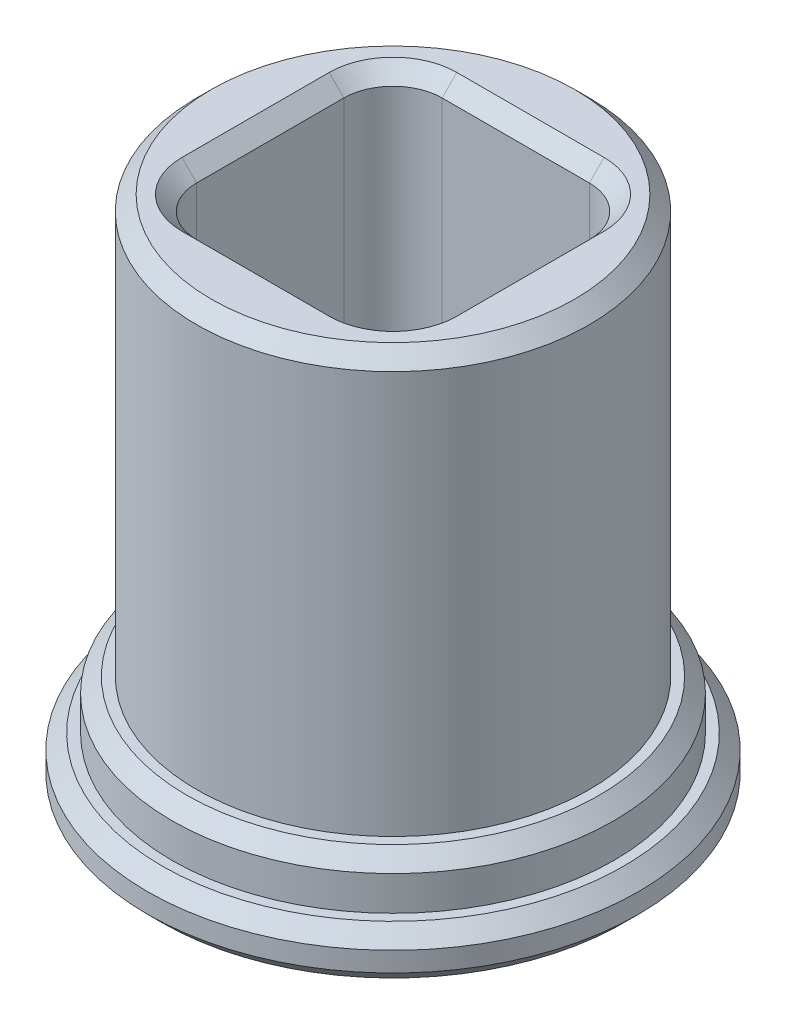
from build123d import *

# Parameters (mm, degrees)
SKETCH_1_R          = 5
SKETCH_1_R_2        = 4.5
EXTRUDE_1_DEPTH     = 1
SKETCH_1_5_R        = 4.5
SKETCH_1_5_R_2      = 4
EXTRUDE_2_DEPTH     = 2
SKETCH_1_6_R        = 4
SKETCH_1_6_W        = 5
SKETCH_1_6_H        = 5
EXTRUDE_3_DEPTH     = 10.5
CUT_EXTRUDE_START   = 10.5
SKETCH_1_7_W        = 5
SKETCH_1_7_H        = 5
CUT_EXTRUDE_1_DEPTH = 6
SKETCH_2_R          = 2.2
CUT_EXTRUDE_2_DEPTH = 20
SKETCH_3_R          = 3.75
CUT_EXTRUDE_4_DEPTH = 1
FILLET_1_R          = 1
CHAMFER_1_SIZE      = 0.3


with BuildPart() as part:
    # 스케치1 → 보스-돌출1 (new body)
    with BuildSketch(Plane(origin=(0, 0, 0), x_dir=(1, 0, 0), z_dir=(0, 1, 0))):
        with Locations(Location((0, 0, 0), (0, 0, 270))):
            Circle(SKETCH_1_R)
        with Locations(Location((0, 0, 0), (0, 0, 270))):
            Circle(SKETCH_1_R_2, mode=Mode.SUBTRACT)
    extrude(amount=EXTRUDE_1_DEPTH)

    # 스케치1<5> → 보스-돌출2 (add)
    with BuildSketch(Plane(origin=(0, 0, 0), x_dir=(1, 0, 0), z_dir=(0, 1, 0))):
        with Locations(Location((0, 0, 0), (0, 0, 270))):
            Circle(SKETCH_1_5_R)
        with Locations(Location((0, 0, 0), (0, 0, 270))):
            Circle(SKETCH_1_5_R_2, mode=Mode.SUBTRACT)
    extrude(amount=EXTRUDE_2_DEPTH)

    # 스케치1<6> → 보스-돌출3 (add)
    # profile 1 of 2: a face of its own
    with BuildSketch(Plane(origin=(0, 0, 0), x_dir=(1, 0, 0), z_dir=(0, 1, 0))):
        with Locations(Location((0, 0, 0), (0, 0, 90))):
            Circle(SKETCH_1_6_R)
        Rectangle(SKETCH_1_6_W, SKETCH_1_6_H, mode=Mode.SUBTRACT)
    # profile 2 of 2: a face of its own
    with BuildSketch(Plane(origin=(0, 0, 0), x_dir=(1, 0, 0), z_dir=(0, 1, 0))):
        Rectangle(SKETCH_1_6_W, SKETCH_1_6_H)
    extrude(amount=EXTRUDE_3_DEPTH)

    # 스케치1<7> → 컷-돌출1 (cut)
    with BuildSketch(Plane(origin=(0, 0, 0), x_dir=(1, 0, 0), z_dir=(0, 1, 0)).offset(CUT_EXTRUDE_START)):
        Rectangle(SKETCH_1_7_W, SKETCH_1_7_H)
    extrude(amount=-CUT_EXTRUDE_1_DEPTH, mode=Mode.SUBTRACT)

    # 스케치2 → 컷-돌출2 (cut)
    with BuildSketch(Plane.XZ):
        with Locations(Location((0, 0, 0), (0, 0, 270))):
            Circle(SKETCH_2_R)
    extrude(amount=-CUT_EXTRUDE_2_DEPTH, mode=Mode.SUBTRACT)

    # 스케치3 → 컷-돌출4 (cut)
    with BuildSketch(Plane.XZ):
        with Locations(Location((0, 0, 0), (0, 0, 270))):
            Circle(SKETCH_3_R)
    extrude(amount=-CUT_EXTRUDE_4_DEPTH, mode=Mode.SUBTRACT)

    # 필렛1
    fillet_1_edges = [part.edges().sort_by_distance(p)[0] for p in [
        (-2.5, 7.5, 2.5),
        (-2.5, 7.5, -2.5),
        (2.5, 7.5, -2.5),
        (2.5, 7.5, 2.5),
    ]]
    fillet(fillet_1_edges, radius=FILLET_1_R)

    # 모따기1
    chamfer_1_edges = [part.edges().sort_by_distance(p)[0] for p in [
        (0, 2, -4.5),
        (0, 1, -5),
        (0, 10.5, 4),
        (0, 0, -5),
        (0, 0, 3.75),
        (0, 1, 2.2),
        (2.5, 10.5, 0),
        (0, 10.5, 2.5),
        (-2.5, 10.5, 0),
        (0, 10.5, -2.5),
        (2.207106781, 10.5, 2.207106781),
        (-2.207106781, 10.5, 2.207106781),
        (2.207106781, 10.5, -2.207106781),
        (-2.207106781, 10.5, -2.207106781),
    ]]
    chamfer(chamfer_1_edges, length=CHAMFER_1_SIZE)


solid = part.part
